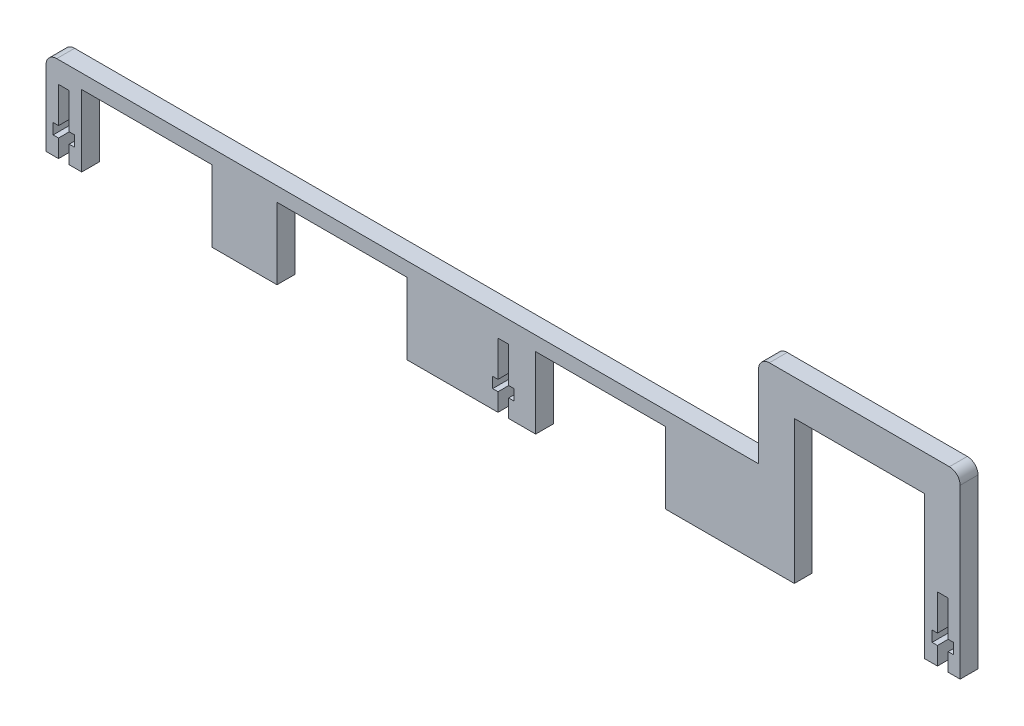
from build123d import *

# Parameters (mm, degrees)
BOSS_EXTRU_1_DEPTH         = 5
ENL_V_MAT_EXTRU_2_DEPTH    = 5
R_P_TITION_LIN_AIRE1_COUNT = 3
R_P_TITION_LIN_AIRE1_PITCH = 123


with BuildPart() as part:
    # Esquisse1 → Boss.-Extru.1 (new body)
    with BuildSketch(Plane.XY):
        with BuildLine():
            Line((0, 0), (0, 21))
            ThreePointArc((0, 21), (0.878679656, 23.121320344), (3, 24))
            Line((3, 24), (199.45, 24))
            Line((199.45, 24), (199.45, 47))
            ThreePointArc((199.45, 47), (200.328679656, 49.121320344), (202.45, 50))
            Line((202.45, 50), (252.85, 50))
            ThreePointArc((252.85, 50), (254.971320344, 49.121320344), (255.85, 47))
            Line((255.85, 47), (255.85, 0))
            Line((255.85, 0), (245.85, 0))
            Line((245.85, 0), (245.85, 40))
            Line((245.85, 40), (209.45, 40))
            Line((209.45, 40), (209.45, 0))
            Line((209.45, 0), (173.45, 0))
            Line((173.45, 0), (173.45, 20))
            Line((173.45, 20), (137.05, 20))
            Line((137.05, 20), (137.05, 0))
            Line((137.05, 0), (101.05, 0))
            Line((101.05, 0), (101.05, 20))
            Line((101.05, 20), (64.65, 20))
            Line((64.65, 20), (64.65, 0))
            Line((64.65, 0), (46.4, 0))
            Line((46.4, 0), (46.4, 20))
            Line((46.4, 20), (10, 20))
            Line((10, 20), (10, 0))
            Line((10, 0), (0, 0))
        make_face()
    extrude(amount=BOSS_EXTRU_1_DEPTH)

    # Esquisse2 → Enlèv. mat.-Extru.2 (cut)
    with BuildSketch(Plane.XY.offset(5)):
        Polygon((6.5, 0), (6.5, 5), (8, 5), (8, 8), (6.5, 8), (6.5, 18), (3.5, 18), (3.5, 8), (2, 8), (2, 5), (3.5, 5), (3.5, 0), align=None)
    enl_v_mat_extru_2 = extrude(amount=-ENL_V_MAT_EXTRU_2_DEPTH, mode=Mode.SUBTRACT)

    # Répétition linéaire1: Enlèv. mat.-Extru.2 ×3
    with Locations(*[(i * R_P_TITION_LIN_AIRE1_PITCH, 0, 0) for i in range(1, R_P_TITION_LIN_AIRE1_COUNT)]):
        add(enl_v_mat_extru_2, mode=Mode.SUBTRACT)


solid = part.part
